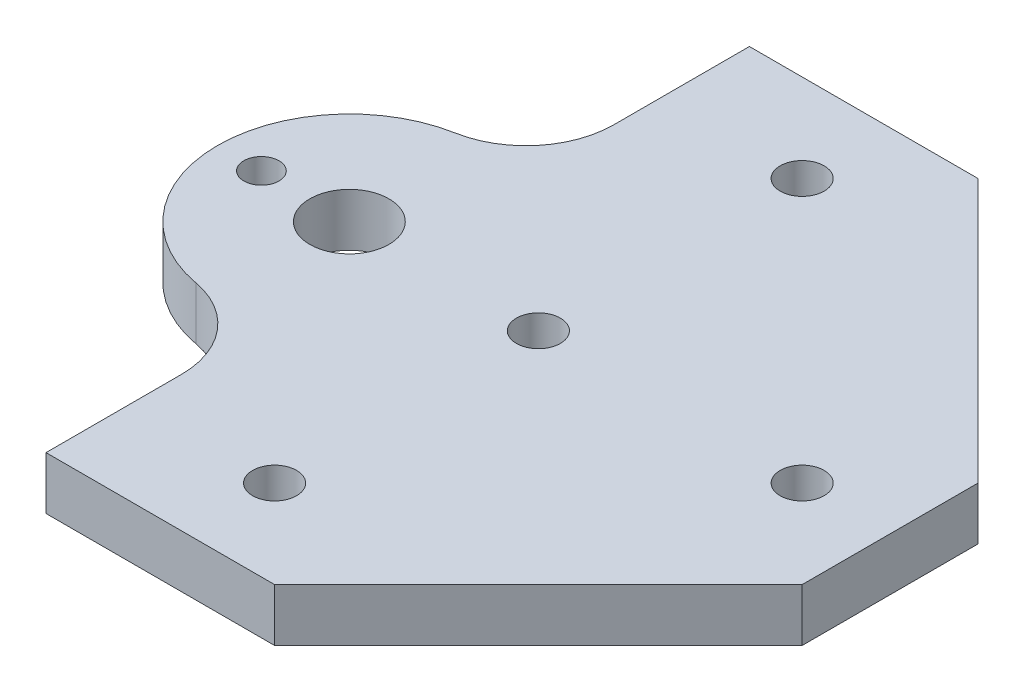
from build123d import *

# Parameters (mm, degrees)
BOSS_EXTRUDE1_DEPTH = 6
FILLET1_R           = 10
SKETCH3_R           = 2.5
SKETCH3_R_2         = 4.5
SKETCH3_R_3         = 2
CUT_EXTRUDE1_DEPTH  = 87.534675131


with BuildPart() as part:
    # Sketch1 → Boss-Extrude1 (new body)
    with BuildSketch(Plane(origin=(0, 0, 0), x_dir=(1, 0, 0), z_dir=(0, 1, 0))):
        with BuildLine():
            Line((0, 0), (0, 10))
            Line((0, 10), (-30, 40))
            Line((-30, 40), (-56, 40))
            Line((-56, 40), (-56, 13.955285737))
            ThreePointArc((-56, 13.955285737), (-76.5, 0), (-56, -13.955285737))
            Line((-56, -13.955285737), (-56, -40))
            Line((-56, -40), (-30, -40))
            Line((-30, -40), (0, -10))
            Line((0, -10), (0, 0))
        make_face()
    extrude(amount=BOSS_EXTRUDE1_DEPTH)

    # Fillet1
    fillet1_edges = [part.edges().sort_by_distance(p)[0] for p in [
        (-56, 3, 13.955285737),
        (-56, 3, -13.955285737),
    ]]
    fillet(fillet1_edges, radius=FILLET1_R)

    # Sketch3 → Cut-Extrude1 (cut, through all)
    with BuildSketch(Plane(origin=(0, 6, 0), x_dir=(1, 0, 0), z_dir=(0, 1, 0))):
        with Locations(Location((-40, 0, 0), (0, 0, 270))):
            Circle(SKETCH3_R)
        with Locations(Location((-40, -30, 0), (0, 0, 270))):
            Circle(SKETCH3_R)
        with Locations(Location((-10, 0, 0), (0, 0, 270))):
            Circle(SKETCH3_R)
        with Locations(Location((-40, 30, 0), (0, 0, 270))):
            Circle(SKETCH3_R)
        with Locations(Location((-61.5, 0, 0), (0, 0, 270))):
            Circle(SKETCH3_R_2)
        with Locations(Location((-71.5, 0, 0), (0, 0, 270))):
            Circle(SKETCH3_R_3)
    extrude(amount=-CUT_EXTRUDE1_DEPTH, mode=Mode.SUBTRACT)


solid = part.part
